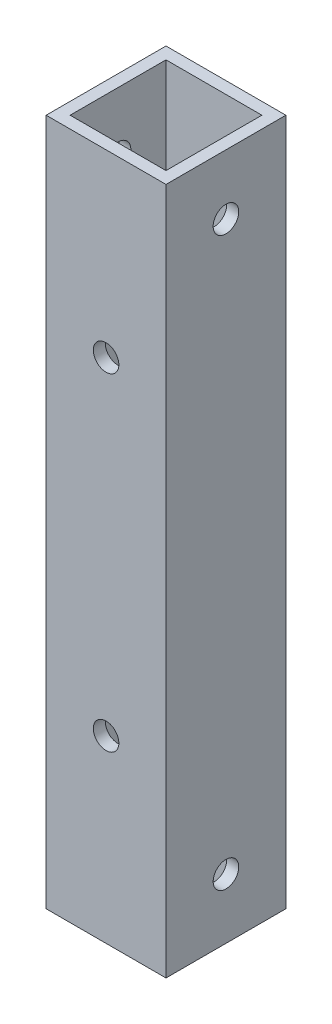
from build123d import *

# Parameters (mm, degrees)
SKETCH_1_W          = 15
SKETCH_1_H          = 15
SKETCH_1_W_2        = 12
SKETCH_1_H_2        = 12
EXTRUDE_1_DEPTH     = 86
SKETCH_2_R          = 1.6
CUT_EXTRUDE_1_DEPTH = 88.619917827
SKETCH_3_R          = 1.6
CUT_EXTRUDE_2_DEPTH = 88.619917827


with BuildPart() as part:
    # ｽｹｯﾁ1 → ﾎﾞｽ - 押し出し1 (new body)
    with BuildSketch(Plane(origin=(0, 0, 0), x_dir=(1, 0, 0), z_dir=(0, 1, 0))):
        Rectangle(SKETCH_1_W, SKETCH_1_H)
        Rectangle(SKETCH_1_W_2, SKETCH_1_H_2, mode=Mode.SUBTRACT)
    extrude(amount=EXTRUDE_1_DEPTH)

    # ｽｹｯﾁ2 → ｶｯﾄ - 押し出し1 (cut, through all)
    with BuildSketch(Plane.XY.offset(7.5)):
        with Locations((0, 63.5)):
            Circle(SKETCH_2_R)
        with Locations((0, 22.5)):
            Circle(SKETCH_2_R)
    extrude(amount=-CUT_EXTRUDE_1_DEPTH, mode=Mode.SUBTRACT)

    # ｽｹｯﾁ3 → ｶｯﾄ - 押し出し2 (cut, through all)
    with BuildSketch(Plane(origin=(7.5, 0, 0), x_dir=(0, 0, -1), z_dir=(1, 0, 0))):
        with Locations((0, 78.5)):
            Circle(SKETCH_3_R)
        with Locations((0, 7.5)):
            Circle(SKETCH_3_R)
    extrude(amount=-CUT_EXTRUDE_2_DEPTH, mode=Mode.SUBTRACT)


solid = part.part
